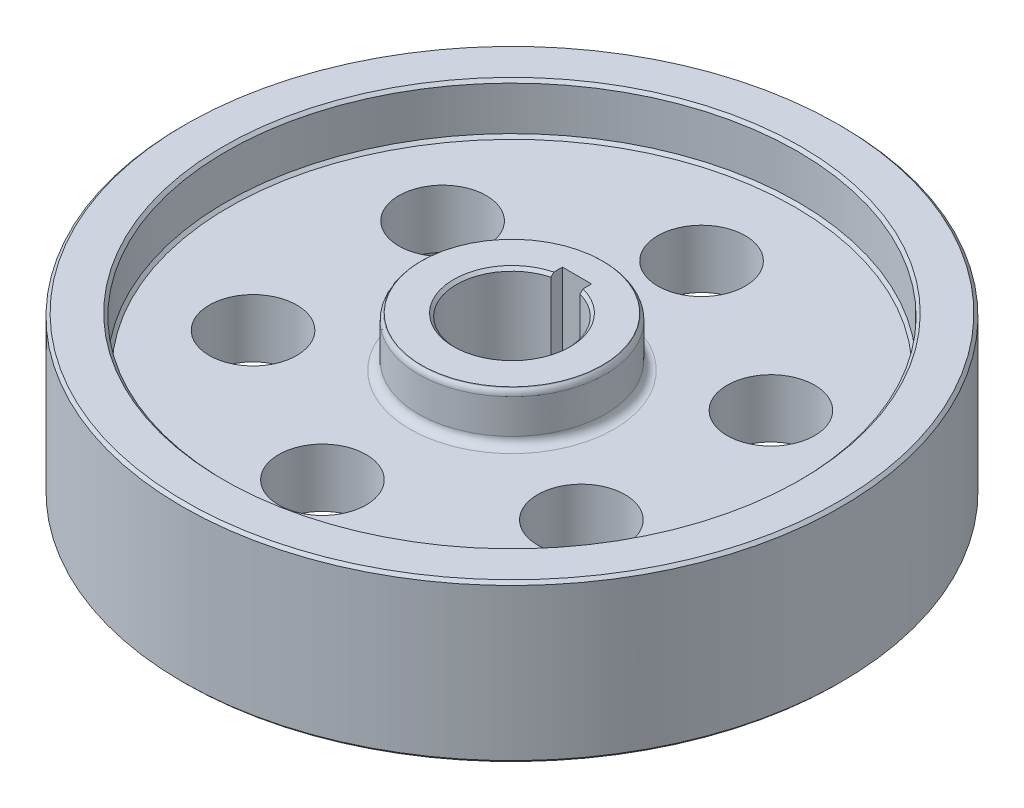
from build123d import *

# Parameters (mm, degrees)
CUT_EXTRUDE_1_DEPTH      = 169.683134901
SKETCH_4_R               = 15
CUT_EXTRUDE_2_DEPTH      = 165.033533157
PATTERN_CIRCULAR_1_COUNT = 6
CHAMFER_1_SIZE           = 1
CHAMFER_2_SIZE           = 1
FILLET_1_R               = 3
FILLET_2_R               = 3


with BuildPart() as part:
    # 草图2 → 旋转1 (revolve)
    with BuildSketch(Plane(origin=(0, 0, 0), x_dir=(0, 0, -1), z_dir=(1, 0, 0)), mode=Mode.PRIVATE) as revolve_1_sk:
        Polygon((0, 0), (0, 18.342006946), (32, 18.342006946), (32, 1.342006946), (98, 1.342006946), (98, 18.342006946), (113, 18.342006946), (113, -13.309731327), (113, -35.657993054), (98, -35.657993054), (98, -18.657993054), (32, -18.657993054), (32, -35.657993054), (0, -35.657993054), (0, -10.537464958), align=None)
    revolve(revolve_1_sk.sketch.rotate(Axis((0, -10.537464958, 0), (0, -1, 0)), 180), axis=Axis((0, -10.537464958, 0), (0, -1, 0)))

    # 草图3 → 切除-拉伸1 (cut, through all)
    with BuildSketch(Plane(origin=(0, 18.342006946, 0), x_dir=(1, 0, 0), z_dir=(0, 1, 0))):
        with BuildLine():
            Line((-5, 18.33030278), (-5, 22.3))
            Line((-5, 22.3), (5, 22.3))
            Line((5, 22.3), (5, 18.33030278))
            ThreePointArc((5, 18.33030278), (0, -19), (-5, 18.33030278))
        make_face()
    extrude(amount=-CUT_EXTRUDE_1_DEPTH, mode=Mode.SUBTRACT)

    # 草图4 → 切除-拉伸2 (cut, through all)
    with BuildSketch(Plane(origin=(0, 1.342006946, 0), x_dir=(1, 0, 0), z_dir=(0, 1, 0))):
        with Locations(Location((0, 65, 0), (0, 0, 270))):
            Circle(SKETCH_4_R)
    cut_extrude_2 = extrude(amount=-CUT_EXTRUDE_2_DEPTH, mode=Mode.SUBTRACT)

    # 阵列(圆周)1: 切除-拉伸2 ×6 about axis
    pattern_circular_1_axis = Axis((0, 0, 0), (0, 1, 0))
    for i in range(1, PATTERN_CIRCULAR_1_COUNT):
        add(cut_extrude_2.rotate(pattern_circular_1_axis, i * 360 / PATTERN_CIRCULAR_1_COUNT), mode=Mode.SUBTRACT)

    # 倒角1
    chamfer_1_edges = [part.edges().sort_by_distance(p)[0] for p in [
        (0, -35.657993054, -113),
        (0, 18.342006946, -113),
    ]]
    chamfer(chamfer_1_edges, length=CHAMFER_1_SIZE)

    # 倒角2
    chamfer_2_edges = [part.edges().sort_by_distance(p)[0] for p in [
        (0, -35.657993054, -32),
        (0, -18.657993054, -98),
        (0, -35.657993054, -98),
        (0, 18.342006946, -98),
        (0, 1.342006946, -98),
        (0, 18.342006946, -32),
        (0, -35.657993054, 19),
        (0, 18.342006946, 19),
    ]]
    chamfer(chamfer_2_edges, length=CHAMFER_2_SIZE)

    # 圆角1
    fillet_1_edges = [part.edges().sort_by_distance(p)[0] for p in [
        (0, 1.342006946, -32),
        (0, 17.342006946, -32),
    ]]
    fillet(fillet_1_edges, radius=FILLET_1_R)

    # 圆角2
    fillet_2_edges = [part.edges().sort_by_distance(p)[0] for p in [
        (0, -18.657993054, -32),
        (0, -34.657993054, -32),
    ]]
    fillet(fillet_2_edges, radius=FILLET_2_R)


solid = part.part
